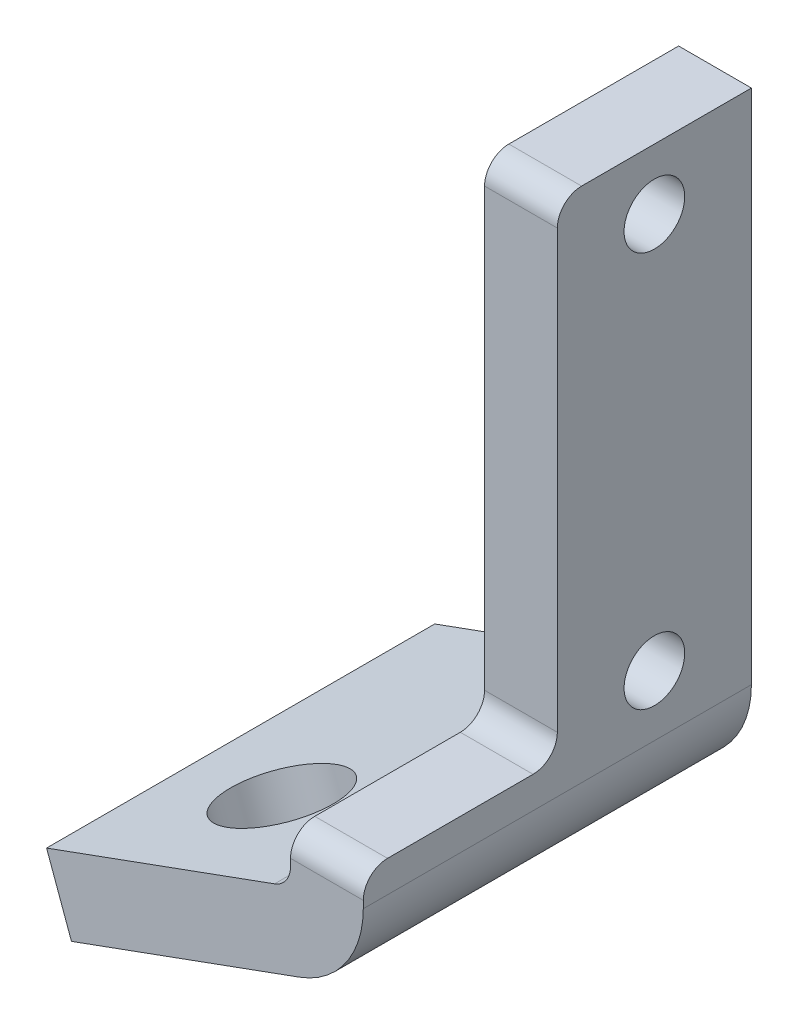
from build123d import *

# Parameters (mm, degrees)
BOSS_EXTRUDE2_DEPTH = 16
SKETCH7_R           = 2.25
CUT_EXTRUDE4_DEPTH  = 30.201645329
SKETCH6_R           = 1.25
SKETCH6_W           = 8
SKETCH6_H           = 20
CUT_EXTRUDE5_DEPTH  = 28.734295303
FILLET2_R           = 1


with BuildPart() as part:
    # Sketch2 → Boss-Extrude2 (new body)
    with BuildSketch(Plane.XY):
        with BuildLine():
            Line((-2.157979857, -1.939692621), (-11.554906065, -5.359894054))
            Line((-11.554906065, -5.359894054), (-10.528845635, -8.178971916))
            Line((-10.528845635, -8.178971916), (-1.131919427, -4.758770483))
            ThreePointArc((-1.131919427, -4.758770483), (0.776608177, -3.294305745), (1.5, -1))
            Line((1.5, -1), (1.5, 20.3))
            Line((1.5, 20.3), (-1.5, 20.3))
            Line((-1.5, 20.3), (-1.5, -1))
            ThreePointArc((-1.5, -1), (-1.680847956, -1.573576436), (-2.157979857, -1.939692621))
        make_face()
    extrude(amount=BOSS_EXTRUDE2_DEPTH)

    # Sketch7 → Cut-Extrude4 (cut, through all)
    with BuildSketch(Plane(origin=(0.370969502, -1.01923033, 0), x_dir=(0.9396926207859104, 0.34202014332566305, 0), z_dir=(-0.3420201433256631, 0.9396926207859105, 0))):
        with Locations(Location((-7.691251695, -11, 0), (0, 0, 180))):
            Circle(SKETCH7_R)
    extrude(amount=-CUT_EXTRUDE4_DEPTH, mode=Mode.SUBTRACT)

    # Sketch6 → Cut-Extrude5 (cut, through all)
    with BuildSketch(Plane.ZY.offset(1.5)):
        with Locations(Location((4, 17.8, 0), (0, 0, 270))):
            Circle(SKETCH6_R)
        with Locations(Location((4, 1.5, 0), (0, 0, 270))):
            Circle(SKETCH6_R)
        with Locations((12, 10.3)):
            Rectangle(SKETCH6_W, SKETCH6_H)
    extrude(amount=-CUT_EXTRUDE5_DEPTH, mode=Mode.SUBTRACT)

    # Fillet2
    fillet2_edges = [part.edges().sort_by_distance(p)[0] for p in [
        (0, 0.3, 16),
        (0, 0.3, 8),
        (0, 20.3, 8),
    ]]
    fillet(fillet2_edges, radius=FILLET2_R)


solid = part.part
